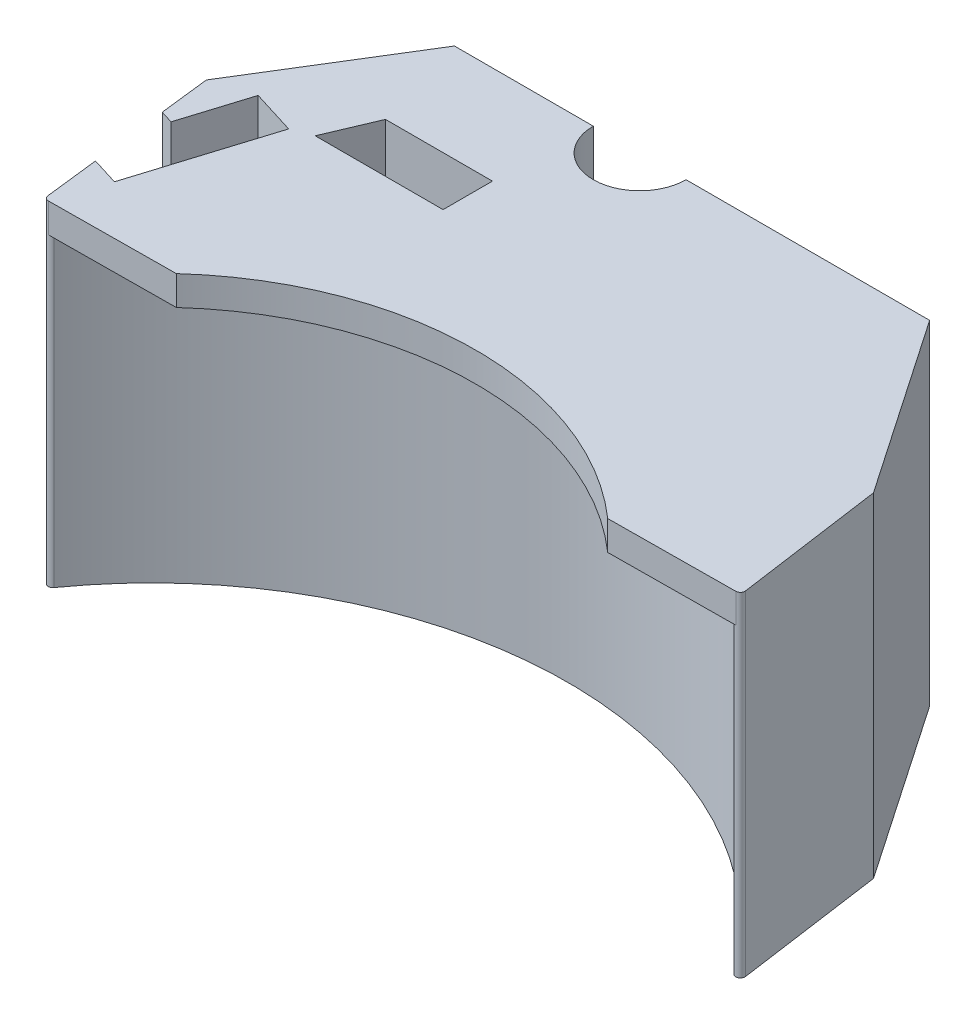
from build123d import *

# Parameters (mm, degrees)
BOSS_EXTRUDE1_DEPTH      = 15.24
BOSS_EXTRUDE1_DEPTH_BACK = 76.2
FILLET1_R                = 1.27
BOSS_EXTRUDE2_DEPTH      = 8.04
CUT_EXTRUDE1_DEPTH       = 50.8
CUT_EXTRUDE2_DEPTH       = 38.1
CUT_EXTRUDE3_DEPTH       = 38.1


with BuildPart() as part:
    # Sketch3 → Boss-Extrude1 (new, two sides: drawn at the far end of the back side and taken through both)
    with BuildSketch(Plane(origin=(0, 0, 0), x_dir=(1, 0, 0), z_dir=(0, 1, 0)).offset(-BOSS_EXTRUDE1_DEPTH_BACK)):
        with BuildLine():
            Line((-475.15475454, -2.10083146), (-513.153172489, -2.10083146))
            Line((-513.153172489, -2.10083146), (-539.064824243, -44.116848998))
            Line((-539.064824243, -44.116848998), (-532.913087574, -96.64839438))
            ThreePointArc((-532.913087574, -96.64839438), (-438.150016702, -46.02), (-343.386945829, -96.64839438))
            Line((-343.386945829, -96.64839438), (-349.858652302, -50.677017736))
            Line((-349.858652302, -50.677017736), (-383.060284532, -2.10083146))
            Line((-383.060284532, -2.10083146), (-449.75475454, -2.10083146))
            ThreePointArc((-449.75475454, -2.10083146), (-462.45475454, -14.80083146), (-475.15475454, -2.10083146))
        make_face()
    extrude(amount=BOSS_EXTRUDE1_DEPTH + BOSS_EXTRUDE1_DEPTH_BACK)

    # Fillet1
    fillet1_edges = [part.edges().sort_by_distance(p)[0] for p in [
        (-532.913087574, -30.48, 96.64839438),
        (-343.386945829, -30.48, 96.64839438),
    ]]
    fillet(fillet1_edges, radius=FILLET1_R)

    # Sketch4 → Boss-Extrude2 (add)
    with BuildSketch(Plane(origin=(0, 15.24, 0), x_dir=(1, 0, 0), z_dir=(0, 1, 0))):
        with BuildLine():
            Line((-380.135465932, -93.16197835), (-345.369151466, -92.873286736))
            ThreePointArc((-345.369151466, -92.873286736), (-439.104227144, -45.107135711), (-532.033153207, -94.423302399))
            Line((-532.033153207, -94.423302399), (-497.266838741, -94.134610785))
            ThreePointArc((-497.266838741, -94.134610785), (-438.886956078, -71.272475515), (-380.135465932, -93.16197835))
        make_face()
    extrude(amount=-BOSS_EXTRUDE2_DEPTH)

    # Sketch5 → Cut-Extrude1 (cut)
    with BuildSketch(Plane(origin=(0, 15.24, 0), x_dir=(1, 0, 0), z_dir=(0, 1, 0))):
        with BuildLine():
            Line((-528.314052027, -40.689759741), (-516.187462201, -44.462798197))
            Line((-516.187462201, -44.462798197), (-527.50657757, -80.842567675))
            Line((-527.50657757, -80.842567675), (-695.232596141, -28.656691245))
            ThreePointArc((-695.232596141, -28.656691245), (-715.264918055, 13.486917548), (-671.654107709, 30.084354228))
            ThreePointArc((-671.654107709, 30.084354228), (-668.860719824, 16.856608708), (-682.026961544, 13.786373146))
            ThreePointArc((-682.026961544, 13.786373146), (-697.926589826, 5.432821776), (-689.573038456, -10.466806506))
            Line((-689.573038456, -10.466806506), (-533.973609712, -58.87964448))
            Line((-533.973609712, -58.87964448), (-528.314052027, -40.689759741))
        make_face()
    extrude(amount=-CUT_EXTRUDE1_DEPTH, mode=Mode.SUBTRACT)

    # Sketch6 → Cut-Extrude2 (cut)
    with BuildSketch(Plane(origin=(0, 15.24, 0), x_dir=(1, 0, 0), z_dir=(0, 1, 0))):
        Polygon((-505.199519379, -28.941561379), (-510.924193781, -42.454904444), (-475.918740123, -42.454904444), (-475.918740123, -28.941649602), align=None)
    extrude(amount=-CUT_EXTRUDE2_DEPTH, mode=Mode.SUBTRACT)

    # Sketch7 → Cut-Extrude3 (cut)
    with BuildSketch(Plane.XZ.offset(76.2)):
        with BuildLine():
            Line((-477.784341144, 30.750375257), (-493.297876549, 29.59254273))
            ThreePointArc((-493.297876549, 29.59254273), (-509.568926068, 36.66140776), (-512.958981795, 54.074719549))
            Line((-512.958981795, 54.074719549), (-477.784341144, 43.499133869))
            Line((-477.784341144, 43.499133869), (-477.784341144, 30.750375257))
        make_face()
    extrude(amount=-CUT_EXTRUDE3_DEPTH, mode=Mode.SUBTRACT)


solid = part.part
